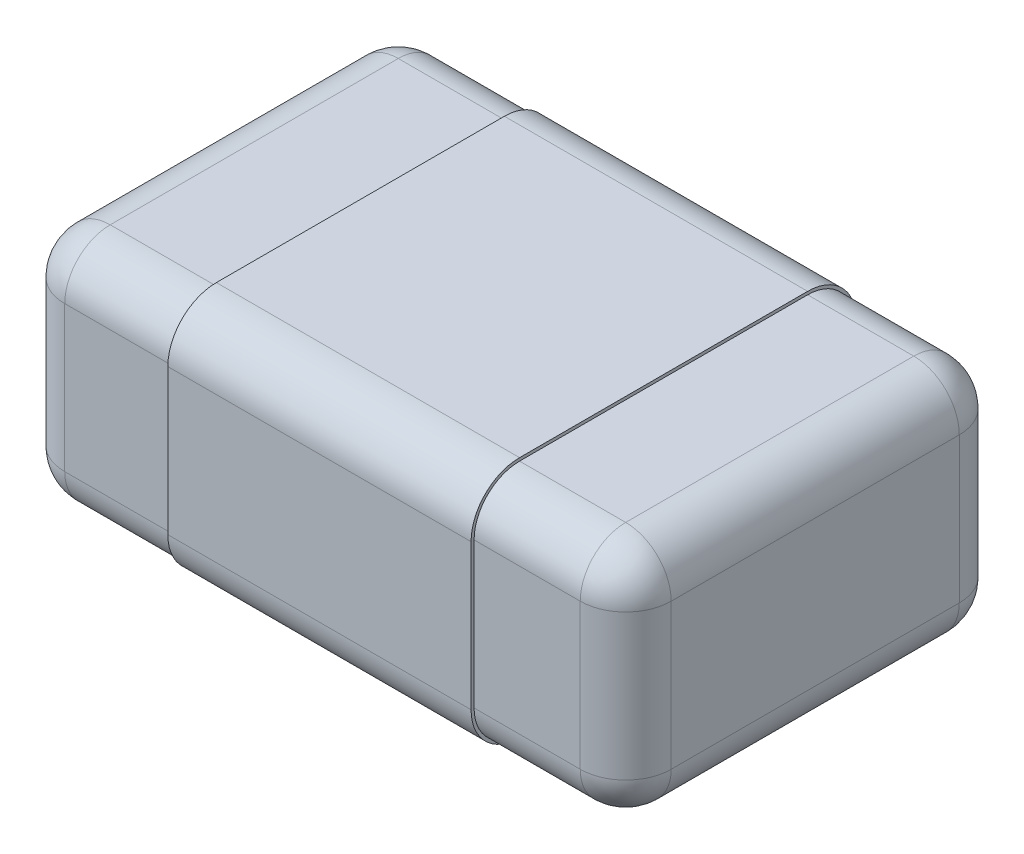
from build123d import *

# Parameters (mm, degrees)
ESBO_O1_W                     = 2
ESBO_O1_H                     = 1.25
RESSALTO_EXTRUS_O1_DEPTH      = 0.78
FILETE1_R                     = 0.15
RESSALTO_EXTRUS_O4_DEPTH      = 0.5
RESSALTO_EXTRUS_O4_DEPTH_BACK = 0.5
RESSALTO_EXTRUS_O5_DEPTH      = 0.02


with BuildPart() as part:
    # Esboço1 → Ressalto-extrusão1 (new body)
    with BuildSketch(Plane(origin=(0, 0, 0), x_dir=(1, 0, 0), z_dir=(0, 1, 0))):
        Rectangle(ESBO_O1_W, ESBO_O1_H)
    extrude(amount=-RESSALTO_EXTRUS_O1_DEPTH)

    # Filete1
    filete1_edges = [part.edges().sort_by_distance(p)[0] for p in [
        (1, -0.78, 0),
        (0, -0.78, -0.625),
        (-1, -0.78, 0),
        (0, 0, -0.625),
        (1, 0, 0),
        (0, 0, 0.625),
        (-1, 0, 0),
        (0, -0.78, 0.625),
        (-1, -0.39, -0.625),
        (1, -0.39, -0.625),
        (1, -0.39, 0.625),
        (-1, -0.39, 0.625),
    ]]
    fillet(filete1_edges, radius=FILETE1_R)

    # Esboço4 → Ressalto-extrusão4 (add, two sides: drawn at the far end of the back side and taken through both)
    with BuildSketch(Plane(origin=(0, 0, 0), x_dir=(0, 0, -1), z_dir=(1, 0, 0)).offset(-RESSALTO_EXTRUS_O4_DEPTH_BACK)):
        with BuildLine():
            Line((0.635, -0.63), (0.635, -0.15))
            ThreePointArc((0.635, -0.15), (0.588137085, -0.036862915), (0.475, 0.01))
            Line((0.475, 0.01), (-0.475, 0.01))
            ThreePointArc((-0.475, 0.01), (-0.588137085, -0.036862915), (-0.635, -0.15))
            Line((-0.635, -0.15), (-0.635, -0.63))
            ThreePointArc((-0.635, -0.63), (-0.588137085, -0.743137085), (-0.475, -0.79))
            Line((-0.475, -0.79), (0.475, -0.79))
            ThreePointArc((0.475, -0.79), (0.588137085, -0.743137085), (0.635, -0.63))
        make_face()
        with BuildLine():
            Line((0.625, -0.63), (0.625, -0.15))
            ThreePointArc((0.625, -0.15), (0.581066017, -0.043933983), (0.475, 0))
            Line((0.475, 0), (-0.475, 0))
            ThreePointArc((-0.475, 0), (-0.581066017, -0.043933983), (-0.625, -0.15))
            Line((-0.625, -0.15), (-0.625, -0.63))
            ThreePointArc((-0.625, -0.63), (-0.581066017, -0.736066017), (-0.475, -0.78))
            Line((-0.475, -0.78), (0.475, -0.78))
            ThreePointArc((0.475, -0.78), (0.581066017, -0.736066017), (0.625, -0.63))
        make_face(mode=Mode.SUBTRACT)
    extrude(amount=RESSALTO_EXTRUS_O4_DEPTH + RESSALTO_EXTRUS_O4_DEPTH_BACK)

    # Esboço2 → Ressalto-extrusão5 (add)
    # profile 1 of 3: a face of its own
    with BuildSketch(Plane(origin=(0, -0.79, 0), x_dir=(0, 0, 1), z_dir=(0, -1, 0))):
        with BuildLine():
            add(Edge.make_bspline(
                [(0.10156651, -0.208860759), (0.106879767, -0.208966614), (0.117339076, -0.209174993), (0.132732901, -0.211067285), (0.147595912, -0.213803794), (0.161733203, -0.218074278), (0.175247857, -0.223104126), (0.187765566, -0.229473852), (0.199456364, -0.236780735), (0.206390579, -0.242629051), (0.209853694, -0.245549842)],
                knots=[0, 0, 0, 0, 1.090749778, 2.147174242, 3.181500652, 4.190524645, 5.176272442, 6.139085895, 7.070614365, 8, 8, 8, 8], degree=3))
            add(Edge.make_bspline(
                [(0.209853694, -0.245549842), (0.21311905, -0.248648627), (0.219631831, -0.254829179), (0.228217986, -0.265315666), (0.235504227, -0.276906839), (0.241897611, -0.289364979), (0.246965872, -0.302854946), (0.250464789, -0.317302021), (0.252731878, -0.332635304), (0.252955078, -0.343181184), (0.253069675, -0.348595728)],
                knots=[0, 0, 0, 0, 0.936773621, 1.868402867, 2.812865456, 3.782922538, 4.779926453, 5.805444567, 6.873255087, 8, 8, 8, 8], degree=3))
            add(Edge.make_bspline(
                [(0.253069675, -0.348595728), (0.252954756, -0.354339207), (0.252731949, -0.365474785), (0.250494446, -0.381642598), (0.246897537, -0.396750095), (0.241711627, -0.41070826), (0.235397547, -0.423499389), (0.227989531, -0.435087699), (0.219656812, -0.44561204), (0.213104073, -0.451559402), (0.209853694, -0.454509494)],
                knots=[0, 0, 0, 0, 1.166767194, 2.262152815, 3.310312399, 4.317229814, 5.282073077, 6.203969335, 7.109108255, 8, 8, 8, 8], degree=3))
            add(Edge.make_bspline(
                [(0.209853694, -0.454509494), (0.206450197, -0.457196472), (0.199608489, -0.462597834), (0.18818415, -0.469259267), (0.176017937, -0.475072744), (0.162950677, -0.479549924), (0.149297072, -0.482941808), (0.135240375, -0.48557209), (0.120750896, -0.487056172), (0.110964504, -0.487245866), (0.106016669, -0.487341772)],
                knots=[0, 0, 0, 0, 0.935651317, 1.880845668, 2.849172241, 3.844532839, 4.858290914, 5.886229154, 6.931312905, 8, 8, 8, 8], degree=3))
            add(Edge.make_bspline(
                [(0.106016669, -0.487341772), (0.099116071, -0.487130849), (0.085835493, -0.486724917), (0.066767801, -0.483694055), (0.049526906, -0.47846458), (0.033973962, -0.471159882), (0.020089772, -0.461670912), (0.007488682, -0.450389649), (-0.004090117, -0.43734813), (-0.010474264, -0.427440666), (-0.013742034, -0.422369462)],
                knots=[0, 0, 0, 0, 1.155460097, 2.223746009, 3.222673704, 4.163574145, 5.089979746, 6.028496165, 6.990872086, 8, 8, 8, 8], degree=3))
            Line((-0.013742034, -0.422369462), (-0.015818775, -0.422369462))
            add(Edge.make_bspline(
                [(-0.015818775, -0.422369462), (-0.019487518, -0.426963377), (-0.026656376, -0.435940054), (-0.039307386, -0.447320798), (-0.053073973, -0.456567943), (-0.068057105, -0.463459718), (-0.083987182, -0.468447164), (-0.100697057, -0.472100641), (-0.118342756, -0.474333407), (-0.130395462, -0.47456498), (-0.136566401, -0.474683544)],
                knots=[0, 0, 0, 0, 1.028847228, 2.010405056, 2.968496506, 3.92470531, 4.889287898, 5.888668269, 6.919006392, 8, 8, 8, 8], degree=3))
            add(Edge.make_bspline(
                [(-0.136566401, -0.474683544), (-0.141122544, -0.474614769), (-0.150102575, -0.474479214), (-0.163333834, -0.472613083), (-0.176222372, -0.470202453), (-0.18858602, -0.466327908), (-0.20052938, -0.461700457), (-0.211668091, -0.455615235), (-0.222429111, -0.448898386), (-0.228862529, -0.443418948), (-0.232096464, -0.440664557)],
                knots=[0, 0, 0, 0, 1.053534326, 2.07648671, 3.087937488, 4.084693284, 5.07073428, 6.046837634, 7.018188738, 8, 8, 8, 8], degree=3))
            add(Edge.make_bspline(
                [(-0.232096464, -0.440664557), (-0.235033406, -0.437895068), (-0.240992408, -0.432275824), (-0.248734939, -0.422529881), (-0.255613547, -0.411751512), (-0.261507163, -0.399991226), (-0.26644512, -0.387355948), (-0.269708194, -0.373777924), (-0.271878422, -0.359510856), (-0.272122449, -0.349724901), (-0.272246781, -0.344738924)],
                knots=[0, 0, 0, 0, 0.903175367, 1.832526527, 2.778734086, 3.7626714, 4.774575425, 5.809567684, 6.883967541, 8, 8, 8, 8], degree=3))
            add(Edge.make_bspline(
                [(-0.272246781, -0.344738924), (-0.272151383, -0.339457917), (-0.271966489, -0.32922263), (-0.270017631, -0.314432912), (-0.267048808, -0.300679126), (-0.262604859, -0.288071638), (-0.257309749, -0.276456028), (-0.251023062, -0.265980087), (-0.244154146, -0.256424906), (-0.238792828, -0.25092835), (-0.236151053, -0.248219937)],
                knots=[0, 0, 0, 0, 1.196021461, 2.318046731, 3.374579858, 4.378577803, 5.341149929, 6.262250503, 7.143728432, 8, 8, 8, 8], degree=3))
            add(Edge.make_bspline(
                [(-0.236151053, -0.248219937), (-0.233304845, -0.245647358), (-0.227572916, -0.240466486), (-0.217912552, -0.233878989), (-0.207433738, -0.228200548), (-0.196166483, -0.223481752), (-0.184188851, -0.219707606), (-0.171665328, -0.217093431), (-0.158664175, -0.215432945), (-0.149856128, -0.215271925), (-0.145367825, -0.215189873)],
                knots=[0, 0, 0, 0, 0.929209895, 1.871319939, 2.826088975, 3.814576506, 4.828105117, 5.865701633, 6.912428806, 8, 8, 8, 8], degree=3))
            add(Edge.make_bspline(
                [(-0.145367825, -0.215189873), (-0.139523445, -0.215390831), (-0.128096809, -0.215783733), (-0.111350344, -0.218549325), (-0.095583537, -0.223484275), (-0.0805949, -0.230082649), (-0.066657411, -0.238780562), (-0.053786771, -0.249424668), (-0.042207303, -0.262240711), (-0.035678553, -0.27193318), (-0.032333806, -0.276898734)],
                knots=[0, 0, 0, 0, 1.039845221, 2.033052711, 3.008945594, 3.972545647, 4.93935367, 5.922412001, 6.935629842, 8, 8, 8, 8], degree=3))
            Line((-0.032333806, -0.276898734), (-0.030355958, -0.276898734))
            add(Edge.make_bspline(
                [(-0.030355958, -0.276898734), (-0.026891269, -0.27134189), (-0.020098135, -0.260446718), (-0.007320301, -0.246365232), (0.006801666, -0.234377243), (0.022705907, -0.224894226), (0.040183962, -0.217665909), (0.059241428, -0.212600533), (0.079861724, -0.209317284), (0.09416922, -0.209016349), (0.10156651, -0.208860759)],
                knots=[0, 0, 0, 0, 1.004272695, 1.969053655, 2.907312273, 3.840967393, 4.801231943, 5.803715401, 6.864472521, 8, 8, 8, 8], degree=3))
        make_face()
        with BuildLine():
            add(Edge.make_bspline(
                [(-0.132215135, -0.297468354), (-0.136380522, -0.297607051), (-0.144357184, -0.297872653), (-0.155710072, -0.300247183), (-0.165760247, -0.304300455), (-0.174359999, -0.309992096), (-0.181409401, -0.316982423), (-0.18639881, -0.325426358), (-0.189458951, -0.335005481), (-0.189794798, -0.341814614), (-0.1899683, -0.345332278)],
                knots=[0, 0, 0, 0, 1.182217376, 2.263931421, 3.275960966, 4.242069709, 5.17568556, 6.070163463, 7.003027686, 8, 8, 8, 8], degree=3))
            add(Edge.make_bspline(
                [(-0.1899683, -0.345332278), (-0.189807673, -0.348680147), (-0.189495162, -0.35519363), (-0.186765296, -0.364457842), (-0.182196498, -0.372688355), (-0.175926912, -0.379715958), (-0.168300215, -0.385313756), (-0.159752876, -0.389426104), (-0.150395642, -0.392012357), (-0.14386849, -0.392271965), (-0.140522097, -0.392405063)],
                knots=[0, 0, 0, 0, 1.049890576, 2.042626796, 3.002028929, 3.984834553, 4.97676053, 5.953877561, 6.950977715, 8, 8, 8, 8], degree=3))
            add(Edge.make_bspline(
                [(-0.140522097, -0.392405063), (-0.137184919, -0.392325846), (-0.130836687, -0.392175151), (-0.121853582, -0.390626236), (-0.113810147, -0.388386658), (-0.106803441, -0.384740731), (-0.100394881, -0.380191481), (-0.094562106, -0.374438372), (-0.088668044, -0.36794172), (-0.08537079, -0.362888497), (-0.083658964, -0.360265032)],
                knots=[0, 0, 0, 0, 1.162060237, 2.210558868, 3.170354972, 4.05944165, 4.949122241, 5.900141539, 6.909823035, 8, 8, 8, 8], degree=3))
            add(Edge.make_bspline(
                [(-0.083658964, -0.360265032), (-0.082012351, -0.357646352), (-0.078512447, -0.352080304), (-0.07450678, -0.344503212), (-0.071066065, -0.337503692), (-0.067880233, -0.331349914), (-0.064452222, -0.324295514), (-0.06200498, -0.31935482), (-0.060715926, -0.316752373)],
                knots=[0, 0, 0, 0, 1.130971294, 2.403898383, 3.131735732, 3.983592061, 4.937882926, 6, 6, 6, 6], degree=3))
            add(Edge.make_bspline(
                [(-0.060715926, -0.316752373), (-0.06641069, -0.313690527), (-0.077319205, -0.307825457), (-0.091807652, -0.30276703), (-0.103354837, -0.299851572), (-0.112473982, -0.298576407), (-0.12214047, -0.297610842), (-0.128784071, -0.297516881), (-0.132215135, -0.297468354)],
                knots=[0, 0, 0, 0, 1.549968566, 2.969017665, 3.669516752, 4.405879138, 5.176721824, 6, 6, 6, 6], degree=3))
        make_face(mode=Mode.SUBTRACT)
        with BuildLine():
            add(Edge.make_bspline(
                [(0.108884548, -0.291139241), (0.104892524, -0.291228581), (0.097338883, -0.291397628), (0.086716555, -0.292782084), (0.077593058, -0.295395397), (0.069449939, -0.298903167), (0.062131212, -0.304490684), (0.054775961, -0.311979186), (0.047110721, -0.32175367), (0.042203605, -0.329237261), (0.039560972, -0.333267405)],
                knots=[0, 0, 0, 0, 1.110467001, 2.10120692, 2.969029817, 3.74460568, 4.551581512, 5.511195423, 6.65970232, 8, 8, 8, 8], degree=3))
            add(Edge.make_bspline(
                [(0.039560972, -0.333267405), (0.038735839, -0.334651212), (0.036934921, -0.337671479), (0.034047572, -0.342569534), (0.031006642, -0.348389595), (0.026545619, -0.356887997), (0.021202914, -0.367441755), (0.016673954, -0.37560565), (0.014541194, -0.379450158)],
                knots=[0, 0, 0, 0, 0.552049761, 1.204892215, 1.947677355, 2.801446134, 4.49374991, 6, 6, 6, 6], degree=3))
            add(Edge.make_bspline(
                [(0.014541194, -0.379450158), (0.016924719, -0.381101087), (0.021810016, -0.384484847), (0.02983363, -0.389035361), (0.038590124, -0.393345065), (0.048055111, -0.397414063), (0.058178612, -0.400969933), (0.068989041, -0.403217528), (0.080224882, -0.404805178), (0.087880495, -0.404976243), (0.091776162, -0.405063291)],
                knots=[0, 0, 0, 0, 0.84097559, 1.723672222, 2.673327577, 3.671825391, 4.712366938, 5.779946806, 6.870294663, 8, 8, 8, 8], degree=3))
            add(Edge.make_bspline(
                [(0.091776162, -0.405063291), (0.097495389, -0.40486813), (0.108436295, -0.404494785), (0.123933068, -0.401309642), (0.137697186, -0.396101078), (0.147575586, -0.389782828), (0.154410419, -0.383948152), (0.158812382, -0.379176351), (0.162447345, -0.373979921), (0.165588309, -0.368566756), (0.167831349, -0.362736718), (0.169521031, -0.356646626), (0.170685242, -0.350188995), (0.170755333, -0.345733107), (0.170791194, -0.343453323)],
                knots=[0, 0, 0, 0, 1.82868677, 3.498286175, 5.038063267, 6.513020263, 7.223581439, 7.910491715, 8.583738502, 9.249756143, 9.907958278, 10.575977979, 11.271421629, 12, 12, 12, 12], degree=3))
            add(Edge.make_bspline(
                [(0.170791194, -0.343453323), (0.170629135, -0.340764778), (0.170278642, -0.334950114), (0.167480803, -0.326202518), (0.163710247, -0.317041453), (0.159339027, -0.311911448), (0.157144042, -0.309335443)],
                knots=[0, 0, 0, 0, 0.858646439, 1.857042177, 2.923925168, 4, 4, 4, 4], degree=3))
            add(Edge.make_bspline(
                [(0.157144042, -0.309335443), (0.154335994, -0.306742767), (0.148657165, -0.301499496), (0.139976584, -0.296703691), (0.132147574, -0.293795496), (0.125230732, -0.292264447), (0.117386274, -0.291254492), (0.111822037, -0.291179062), (0.108884548, -0.291139241)],
                knots=[0, 0, 0, 0, 1.291292098, 2.611431705, 3.325135324, 4.116172842, 5.005484342, 6, 6, 6, 6], degree=3))
        make_face(mode=Mode.SUBTRACT)
    # profile 2 of 3: a face of its own
    with BuildSketch(Plane(origin=(0, -0.79, 0), x_dir=(0, 0, 1), z_dir=(0, -1, 0))):
        with BuildLine():
            Line((0.240411447, 0.120886076), (0.240411447, -0.125949367))
            Line((0.240411447, -0.125949367), (0.158330751, -0.125949367))
            add(Edge.make_bspline(
                [(0.158330751, -0.125949367), (0.152214367, -0.120887492), (0.140208237, -0.110951304), (0.12230397, -0.0966561), (0.104986645, -0.083034363), (0.088088852, -0.070297559), (0.071638652, -0.058342649), (0.055729879, -0.0469833), (0.04010761, -0.036552305), (0.02977976, -0.029910657), (0.024727112, -0.026661392)],
                knots=[0, 0, 0, 0, 1.143871494, 2.245357909, 3.300914739, 4.318253735, 5.293884102, 6.230829319, 7.13447631, 8, 8, 8, 8], degree=3))
            add(Edge.make_bspline(
                [(0.024727112, -0.026661392), (0.018467772, -0.022807477), (0.00649251, -0.01543423), (-0.011299949, -0.005831909), (-0.027841839, 0.002212488), (-0.043428254, 0.008711535), (-0.058501424, 0.013740093), (-0.073657737, 0.017037996), (-0.088968207, 0.019226969), (-0.099276497, 0.019489231), (-0.104426369, 0.019620253)],
                knots=[0, 0, 0, 0, 1.267768508, 2.425473269, 3.486024264, 4.439590646, 5.336903618, 6.222592004, 7.112032784, 8, 8, 8, 8], degree=3))
            add(Edge.make_bspline(
                [(-0.104426369, 0.019620253), (-0.109973533, 0.019457389), (-0.120442742, 0.019150014), (-0.135183808, 0.016680702), (-0.147862366, 0.012207249), (-0.158544157, 0.006120486), (-0.16699737, -0.001718213), (-0.172986786, -0.011118674), (-0.176714501, -0.021909536), (-0.177106684, -0.029597078), (-0.177310072, -0.033583861)],
                knots=[0, 0, 0, 0, 1.306909451, 2.466541577, 3.505869428, 4.459795217, 5.344572835, 6.193571478, 7.063180651, 8, 8, 8, 8], degree=3))
            add(Edge.make_bspline(
                [(-0.177310072, -0.033583861), (-0.177088445, -0.037797417), (-0.176649647, -0.046139784), (-0.172906717, -0.058228164), (-0.167362161, -0.069794193), (-0.162961227, -0.077292083), (-0.160696148, -0.081151108)],
                knots=[0, 0, 0, 0, 0.988472559, 1.957064427, 2.948539211, 4, 4, 4, 4], degree=3))
            add(Edge.make_bspline(
                [(-0.160696148, -0.081151108), (-0.158162705, -0.084765881), (-0.153335217, -0.091653849), (-0.14551733, -0.100442138), (-0.138585493, -0.107235065), (-0.134646389, -0.111371202), (-0.133006275, -0.113093354)],
                knots=[0, 0, 0, 0, 1.249878488, 2.381649198, 3.326171657, 4, 4, 4, 4], degree=3))
            Line((-0.133006275, -0.113093354), (-0.133006275, -0.119620253))
            Line((-0.133006275, -0.119620253), (-0.241293458, -0.119620253))
            add(Edge.make_bspline(
                [(-0.241293458, -0.119620253), (-0.243030602, -0.116915918), (-0.246833272, -0.110996035), (-0.251734635, -0.100573059), (-0.256834934, -0.088217246), (-0.26197876, -0.074279085), (-0.266458759, -0.059444232), (-0.269739252, -0.04443776), (-0.271805277, -0.029718517), (-0.272101339, -0.019975966), (-0.272246781, -0.015189873)],
                knots=[0, 0, 0, 0, 0.69970136, 1.531670699, 2.504079761, 3.612943238, 4.767349377, 5.877514774, 6.957315063, 8, 8, 8, 8], degree=3))
            add(Edge.make_bspline(
                [(-0.272246781, -0.015189873), (-0.272145838, -0.010272103), (-0.271949257, -0.000695027), (-0.270052265, 0.013195591), (-0.266883874, 0.026152524), (-0.262513205, 0.038190645), (-0.2570145, 0.049402474), (-0.24997581, 0.059529553), (-0.241814993, 0.068790356), (-0.232475839, 0.077159072), (-0.221906303, 0.084420345), (-0.21043315, 0.090921092), (-0.197820463, 0.096215142), (-0.184283525, 0.100709579), (-0.169658558, 0.103983447), (-0.154107163, 0.106468649), (-0.137518514, 0.107964222), (-0.126119876, 0.108138228), (-0.120249154, 0.108227848)],
                knots=[0, 0, 0, 0, 1.059873424, 2.064042983, 3.015596836, 3.930697506, 4.820695307, 5.699957467, 6.581199529, 7.477193696, 8.396013015, 9.341094634, 10.315416404, 11.340324501, 12.412707035, 13.542640562, 14.734368785, 16, 16, 16, 16], degree=3))
            add(Edge.make_bspline(
                [(-0.120249154, 0.108227848), (-0.112856677, 0.108059762), (-0.098089689, 0.107723999), (-0.076109458, 0.104913559), (-0.054324675, 0.100623497), (-0.032644635, 0.094266035), (-0.010659972, 0.085942561), (0.01194365, 0.075421379), (0.035218138, 0.062351564), (0.050657644, 0.052374248), (0.058647207, 0.047211234)],
                knots=[0, 0, 0, 0, 0.92383478, 1.845424201, 2.765944236, 3.697111989, 4.666093288, 5.70224482, 6.810968485, 8, 8, 8, 8], degree=3))
            add(Edge.make_bspline(
                [(0.058647207, 0.047211234), (0.063540545, 0.043836713), (0.073096713, 0.037246632), (0.086879374, 0.027223149), (0.099855338, 0.017352653), (0.111778424, 0.007693196), (0.122497499, -0.001175041), (0.13166194, -0.008894608), (0.139184524, -0.015177183), (0.143567164, -0.018975648), (0.145474738, -0.020628956)],
                knots=[0, 0, 0, 0, 1.293836837, 2.526725554, 3.709287413, 4.842241028, 5.866627263, 6.737584004, 7.450524958, 8, 8, 8, 8], degree=3))
            Line((0.145474738, -0.020628956), (0.145474738, 0.120886076))
            Line((0.145474738, 0.120886076), (0.240411447, 0.120886076))
        make_face()
    # profile 3 of 3: a face of its own
    with BuildSketch(Plane(origin=(0, -0.79, 0), x_dir=(0, 0, 1), z_dir=(0, -1, 0))):
        with BuildLine():
            Line((0.240411447, 0.456962025), (0.240411447, 0.210126582))
            Line((0.240411447, 0.210126582), (0.158330751, 0.210126582))
            add(Edge.make_bspline(
                [(0.158330751, 0.210126582), (0.152214367, 0.215188458), (0.140208237, 0.225124645), (0.12230397, 0.239419849), (0.104986645, 0.253041586), (0.088088852, 0.26577839), (0.071638652, 0.277733301), (0.055729879, 0.289092649), (0.04010761, 0.299523645), (0.02977976, 0.306165292), (0.024727112, 0.309414557)],
                knots=[0, 0, 0, 0, 1.143871494, 2.245357909, 3.300914739, 4.318253735, 5.293884102, 6.230829319, 7.13447631, 8, 8, 8, 8], degree=3))
            add(Edge.make_bspline(
                [(0.024727112, 0.309414557), (0.018467772, 0.313268473), (0.00649251, 0.32064172), (-0.011299949, 0.33024404), (-0.027841839, 0.338288438), (-0.043428254, 0.344787485), (-0.058501424, 0.349816043), (-0.073657737, 0.353113945), (-0.088968207, 0.355302918), (-0.099276497, 0.35556518), (-0.104426369, 0.355696203)],
                knots=[0, 0, 0, 0, 1.267768508, 2.425473269, 3.486024264, 4.439590646, 5.336903618, 6.222592004, 7.112032784, 8, 8, 8, 8], degree=3))
            add(Edge.make_bspline(
                [(-0.104426369, 0.355696203), (-0.109973533, 0.355533338), (-0.120442742, 0.355225964), (-0.135183808, 0.352756651), (-0.147862366, 0.348283198), (-0.158544157, 0.342196435), (-0.16699737, 0.334357737), (-0.172986786, 0.324957276), (-0.176714501, 0.314166414), (-0.177106684, 0.306478871), (-0.177310072, 0.302492089)],
                knots=[0, 0, 0, 0, 1.306909451, 2.466541577, 3.505869428, 4.459795217, 5.344572835, 6.193571478, 7.063180651, 8, 8, 8, 8], degree=3))
            add(Edge.make_bspline(
                [(-0.177310072, 0.302492089), (-0.177088445, 0.298278533), (-0.176649647, 0.289936166), (-0.172906717, 0.277847785), (-0.167362161, 0.266281756), (-0.162961227, 0.258783866), (-0.160696148, 0.254924842)],
                knots=[0, 0, 0, 0, 0.988472559, 1.957064427, 2.948539211, 4, 4, 4, 4], degree=3))
            add(Edge.make_bspline(
                [(-0.160696148, 0.254924842), (-0.158162705, 0.251310068), (-0.153335217, 0.244422101), (-0.14551733, 0.235633811), (-0.138585493, 0.228840884), (-0.134646389, 0.224704747), (-0.133006275, 0.222982595)],
                knots=[0, 0, 0, 0, 1.249878488, 2.381649198, 3.326171657, 4, 4, 4, 4], degree=3))
            Line((-0.133006275, 0.222982595), (-0.133006275, 0.216455696))
            Line((-0.133006275, 0.216455696), (-0.241293458, 0.216455696))
            add(Edge.make_bspline(
                [(-0.241293458, 0.216455696), (-0.243030602, 0.219160031), (-0.246833272, 0.225079915), (-0.251734635, 0.23550289), (-0.256834934, 0.247858703), (-0.26197876, 0.261796864), (-0.266458759, 0.276631717), (-0.269739252, 0.29163819), (-0.271805277, 0.306357432), (-0.272101339, 0.316099983), (-0.272246781, 0.320886076)],
                knots=[0, 0, 0, 0, 0.69970136, 1.531670699, 2.504079761, 3.612943238, 4.767349377, 5.877514774, 6.957315063, 8, 8, 8, 8], degree=3))
            add(Edge.make_bspline(
                [(-0.272246781, 0.320886076), (-0.272145838, 0.325803846), (-0.271949257, 0.335380922), (-0.270052265, 0.349271541), (-0.266883874, 0.362228473), (-0.262513205, 0.374266594), (-0.2570145, 0.385478423), (-0.24997581, 0.395605503), (-0.241814993, 0.404866306), (-0.232475839, 0.413235021), (-0.221906303, 0.420496294), (-0.21043315, 0.426997042), (-0.197820463, 0.432291091), (-0.184283525, 0.436785528), (-0.169658558, 0.440059396), (-0.154107163, 0.442544598), (-0.137518514, 0.444040172), (-0.126119876, 0.444214178), (-0.120249154, 0.444303797)],
                knots=[0, 0, 0, 0, 1.059873424, 2.064042983, 3.015596836, 3.930697506, 4.820695307, 5.699957467, 6.581199529, 7.477193696, 8.396013015, 9.341094634, 10.315416404, 11.340324501, 12.412707035, 13.542640562, 14.734368785, 16, 16, 16, 16], degree=3))
            add(Edge.make_bspline(
                [(-0.120249154, 0.444303797), (-0.112856677, 0.444135712), (-0.098089689, 0.443799948), (-0.076109458, 0.440989509), (-0.054324675, 0.436699446), (-0.032644635, 0.430341984), (-0.010659972, 0.42201851), (0.01194365, 0.411497328), (0.035218138, 0.398427513), (0.050657644, 0.388450198), (0.058647207, 0.383287184)],
                knots=[0, 0, 0, 0, 0.92383478, 1.845424201, 2.765944236, 3.697111989, 4.666093288, 5.70224482, 6.810968485, 8, 8, 8, 8], degree=3))
            add(Edge.make_bspline(
                [(0.058647207, 0.383287184), (0.063540545, 0.379912662), (0.073096713, 0.373322582), (0.086879374, 0.363299098), (0.099855338, 0.353428602), (0.111778424, 0.343769145), (0.122497499, 0.334900909), (0.13166194, 0.327181341), (0.139184524, 0.320898767), (0.143567164, 0.317100301), (0.145474738, 0.315446994)],
                knots=[0, 0, 0, 0, 1.293836837, 2.526725554, 3.709287413, 4.842241028, 5.866627263, 6.737584004, 7.450524958, 8, 8, 8, 8], degree=3))
            Line((0.145474738, 0.315446994), (0.145474738, 0.456962025))
            Line((0.145474738, 0.456962025), (0.240411447, 0.456962025))
        make_face()
    extrude(amount=RESSALTO_EXTRUS_O5_DEPTH)


solid = part.part
